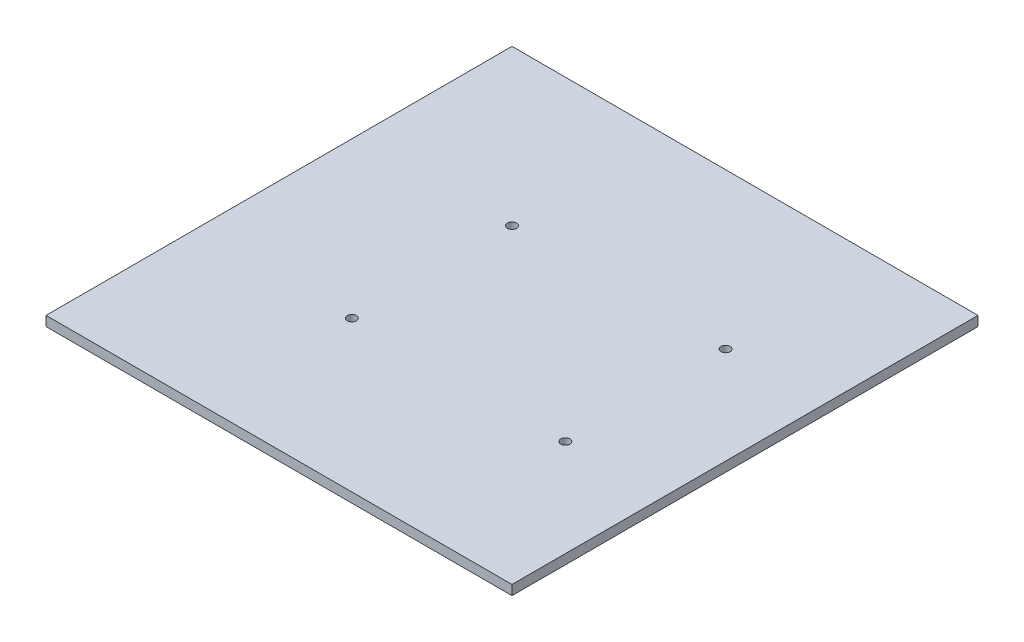
from build123d import *

# Parameters (mm, degrees)
SKETCH1_W           = 152.4
SKETCH1_H           = 152.4
BOSS_EXTRUDE1_DEPTH = 3.175
SKETCH2_R           = 1.5
CUT_EXTRUDE1_DEPTH  = 108.809835474


with BuildPart() as part:
    # Sketch1 → Boss-Extrude1 (new body)
    with BuildSketch(Plane(origin=(0, 0, 0), x_dir=(1, 0, 0), z_dir=(0, 1, 0))):
        Rectangle(SKETCH1_W, SKETCH1_H)
    extrude(amount=BOSS_EXTRUDE1_DEPTH)

    # Sketch2 → Cut-Extrude1 (cut, through all)
    with BuildSketch(Plane(origin=(0, 3.175, 0), x_dir=(1, 0, 0), z_dir=(0, 1, 0))):
        with Locations(Location((-25.4, 25.4, 0), (0, 0, 270))):
            Circle(SKETCH2_R)
        with Locations(Location((-25.4, -26.9875, 0), (0, 0, 270))):
            Circle(SKETCH2_R)
        with Locations(Location((44.45, 25.4, 0), (0, 0, 270))):
            Circle(SKETCH2_R)
        with Locations(Location((44.45, -26.9875, 0), (0, 0, 270))):
            Circle(SKETCH2_R)
    extrude(amount=-CUT_EXTRUDE1_DEPTH, mode=Mode.SUBTRACT)


solid = part.part
